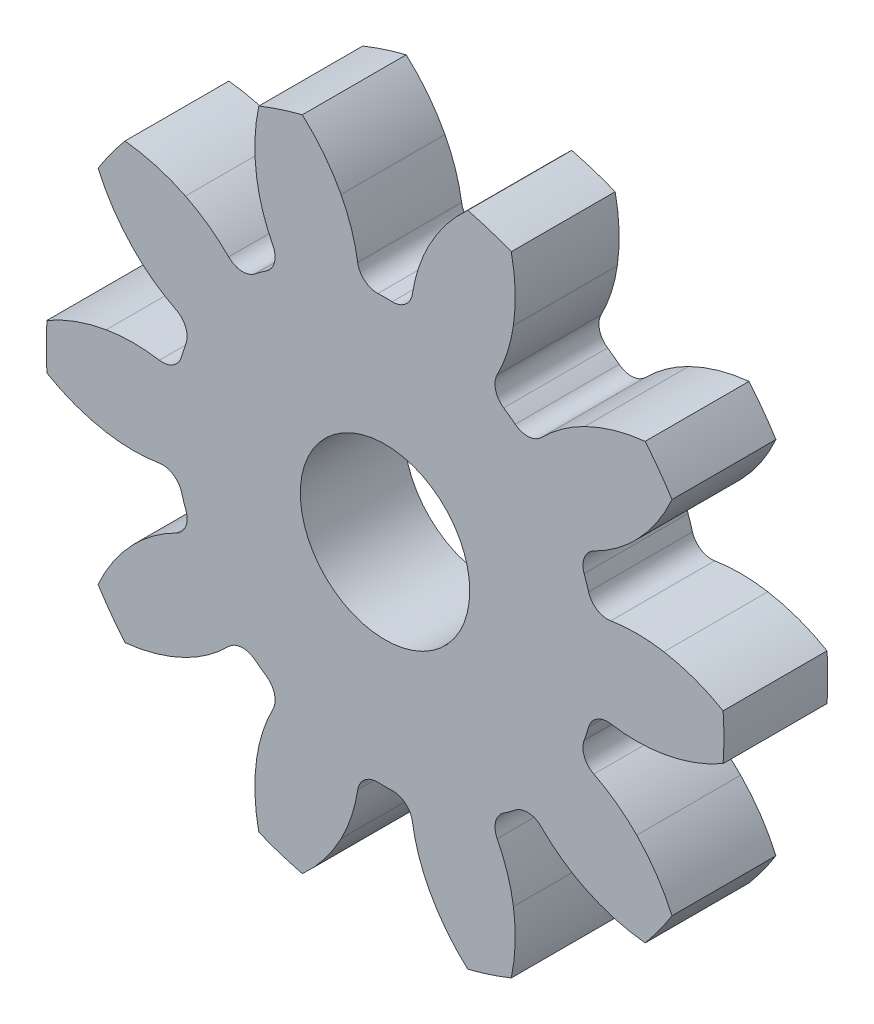
from build123d import *

# Parameters (mm, degrees)
SKETCH1_R        = 19.05
GEAR_BASE_DEPTH  = 2.921
GEAR_CUT_DEPTH   = 28.566899789
GEAR_TEETH_COUNT = 10
SKETCH3_R        = 4.7625
BORE_DEPTH       = 28.171662015


with BuildPart() as part:
    # Sketch1 → GEAR_BASE (new, symmetric)
    with BuildSketch(Plane.XY):
        Circle(SKETCH1_R)
    extrude(amount=GEAR_BASE_DEPTH, both=True)

    # Sketch2 → GEAR_CUT (cut, through all)
    with BuildSketch(Plane.XY.offset(2.921)):
        with BuildLine():
            ThreePointArc((-16.131943581, -10.132270047), (-18.117626635, -5.886773743), (-19.006615415, -1.284939867))
            ThreePointArc((-19.006615415, -1.284939867), (-17.396326331, -2.038349463), (-15.677875368, -2.4939625))
            ThreePointArc((-15.677875368, -2.4939625), (-14.183353381, -2.624371579), (-12.687804586, -2.506319471))
            ThreePointArc((-12.687804586, -2.506319471), (-11.914565866, -2.664132762), (-11.441087583, -3.29549753))
            ThreePointArc((-11.441087583, -3.29549753), (-11.323516647, -3.679233589), (-11.193079136, -4.058789045))
            ThreePointArc((-11.193079136, -4.058789045), (-11.205024214, -4.847877423), (-11.737827153, -5.430049374))
            ThreePointArc((-11.737827153, -5.430049374), (-13.017140833, -6.213604738), (-14.149581986, -7.197565883))
            ThreePointArc((-14.149581986, -7.197565883), (-15.272035395, -8.576244706), (-16.131943581, -10.132270047))
        make_face()
    gear_cut = extrude(amount=-GEAR_CUT_DEPTH, mode=Mode.SUBTRACT)

    # GEAR_TEETH: GEAR_CUT ×10 about axis
    gear_teeth_axis = Axis((0, 0, -3.2131), (0, 0, 1))
    for i in range(1, GEAR_TEETH_COUNT):
        add(gear_cut.rotate(gear_teeth_axis, i * 360 / GEAR_TEETH_COUNT), mode=Mode.SUBTRACT)

    # Sketch3 → BORE (cut, through all)
    with BuildSketch(Plane.XY.offset(2.921)):
        Circle(SKETCH3_R)
    extrude(amount=-BORE_DEPTH, mode=Mode.SUBTRACT)


solid = part.part
